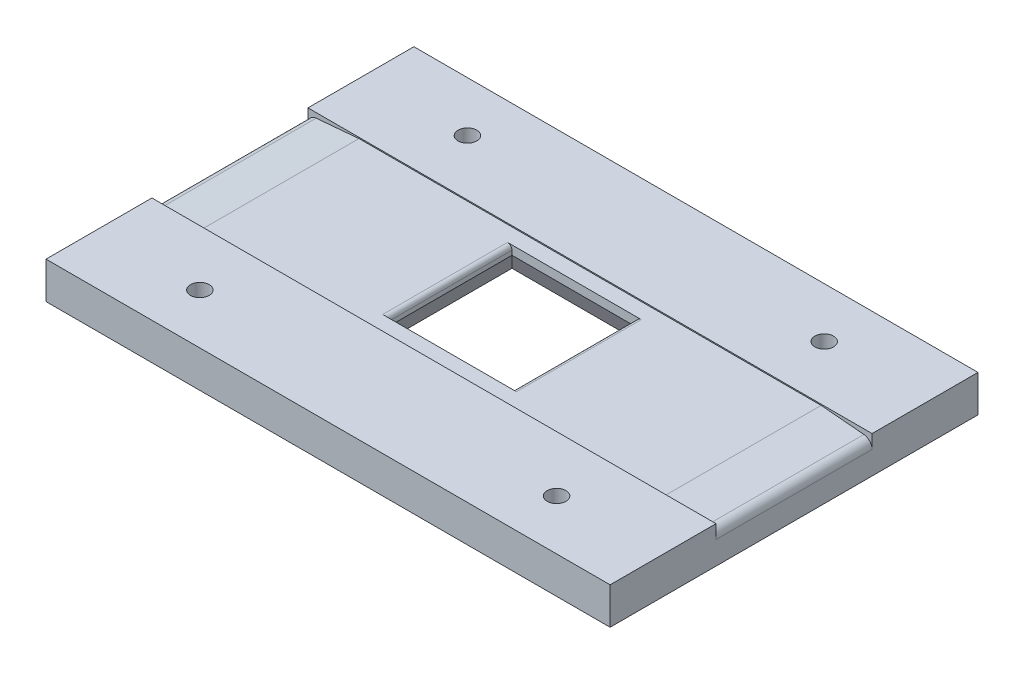
from build123d import *
from OCP.BRepFilletAPI import BRepFilletAPI_MakeChamfer

# Parameters (mm, degrees)
SKETCH_1_W               = 126.5
SKETCH_1_H               = 82.5
SKETCH_1_W_2             = 28
SKETCH_1_H_2             = 28
EXTRUDE_1_DEPTH          = 8
SKETCH_2_W               = 126.5
SKETCH_2_H               = 23.75
EXTRUDE_2_DEPTH          = 0.25
CHAMFER_1_SIZE           = 1
CHAMFER_1_SIZE2          = 11.430052303
FILLET_1_R               = 2
FILLET_2_R               = 1
CUT_EXTRUDE_1_DEPTH      = 76.935005103
CUT_EXTRUDE_1_DEPTH_BACK = 76.935005103
SKETCH_3_R               = 2.1
CHAMFER_2_SIZE           = 6
CHAMFER_2_SIZE2          = 3.464101615
CHAMFER_3_SIZE           = 6
CHAMFER_3_SIZE2          = 3.464101615


with BuildPart() as part:
    # Эскиз1 → Бобышка-Вытянуть1 (new body)
    with BuildSketch(Plane(origin=(0, 0, 0), x_dir=(1, 0, 0), z_dir=(0, 1, 0))):
        Rectangle(SKETCH_1_W, SKETCH_1_H)
        Rectangle(SKETCH_1_W_2, SKETCH_1_H_2, mode=Mode.SUBTRACT)
    extrude(amount=EXTRUDE_1_DEPTH)

    # Эскиз2 → Бобышка-Вытянуть2 (add)
    with BuildSketch(Plane(origin=(0, 8, 0), x_dir=(1, 0, 0), z_dir=(0, 1, 0))):
        with Locations((0, 29.375)):
            Rectangle(SKETCH_2_W, SKETCH_2_H)
        with Locations((0, -29.375)):
            Rectangle(SKETCH_2_W, SKETCH_2_H)
    extrude(amount=EXTRUDE_2_DEPTH)

    # Фаска1: one chamfer whose edges measure the first distance from different faces: ONE call of the kernel's chamfer builder (chamfer() names one face for all edges)
    chamfer_1_edges_1 = [part.edges().sort_by_distance(p)[0] for p in [
        (-63.25, 8, 0),
    ]]
    chamfer_1_side_1 = [part.faces().sort_by_distance(p)[0] for p in [
        (-63.25, 4.072906977, 0),
    ]]
    chamfer_1_edges_2 = [part.edges().sort_by_distance(p)[0] for p in [
        (63.25, 8, 0),
    ]]
    chamfer_1_side_2 = [part.faces().sort_by_distance(p)[0] for p in [
        (63.25, 4.072906977, 0),
    ]]
    chamfer_1 = BRepFilletAPI_MakeChamfer(part.part.solid().wrapped)
    for e in chamfer_1_edges_1:
        chamfer_1.Add(CHAMFER_1_SIZE, CHAMFER_1_SIZE2, e.wrapped, chamfer_1_side_1[0].wrapped)  # the first distance lies on this face
    for e in chamfer_1_edges_2:
        chamfer_1.Add(CHAMFER_1_SIZE, CHAMFER_1_SIZE2, e.wrapped, chamfer_1_side_2[0].wrapped)  # the first distance lies on this face
    add(Compound.cast(chamfer_1.Shape()), mode=Mode.REPLACE)

    # Скругление1
    fillet_1_edges = [part.edges().sort_by_distance(p)[0] for p in [
        (63.25, 7, 0),
        (-63.25, 7, 0),
    ]]
    fillet(fillet_1_edges, radius=FILLET_1_R)

    # Скругление2
    fillet_2_edges = [part.edges().sort_by_distance(p)[0] for p in [
        (-14, 8, 0),
        (14, 8, 0),
    ]]
    fillet(fillet_2_edges, radius=FILLET_2_R)

    # Эскиз3 → Вырез-Вытянуть1 (cut, two sides: drawn at the far end of the back side and taken through both)
    with BuildSketch(Plane(origin=(0, 8, 0), x_dir=(1, 0, 0), z_dir=(0, 1, 0)).offset(-CUT_EXTRUDE_1_DEPTH_BACK)):
        with Locations(Location((-40, 30, 0), (0, 0, 270))):
            Circle(SKETCH_3_R)
        with Locations(Location((40, 30, 0), (0, 0, 270))):
            Circle(SKETCH_3_R)
        with Locations(Location((-40, -30, 0), (0, 0, 270))):
            Circle(SKETCH_3_R)
        with Locations(Location((40, -30, 0), (0, 0, 270))):
            Circle(SKETCH_3_R)
    extrude(amount=CUT_EXTRUDE_1_DEPTH + CUT_EXTRUDE_1_DEPTH_BACK, mode=Mode.SUBTRACT)

    # Фаска2: one chamfer whose edges measure the first distance from different faces: ONE call of the kernel's chamfer builder (chamfer() names one face for all edges)
    chamfer_2_edges_1 = [part.edges().sort_by_distance(p)[0] for p in [
        (-14, 0, 0),
    ]]
    chamfer_2_side_1 = [part.faces().sort_by_distance(p)[0] for p in [
        (-14, 3.5, 0),
    ]]
    chamfer_2_edges_2 = [part.edges().sort_by_distance(p)[0] for p in [
        (14, 0, 0),
    ]]
    chamfer_2_side_2 = [part.faces().sort_by_distance(p)[0] for p in [
        (14, 3.5, 0),
    ]]
    chamfer_2 = BRepFilletAPI_MakeChamfer(part.part.solid().wrapped)
    for e in chamfer_2_edges_1:
        chamfer_2.Add(CHAMFER_2_SIZE, CHAMFER_2_SIZE2, e.wrapped, chamfer_2_side_1[0].wrapped)  # the first distance lies on this face
    for e in chamfer_2_edges_2:
        chamfer_2.Add(CHAMFER_2_SIZE, CHAMFER_2_SIZE2, e.wrapped, chamfer_2_side_2[0].wrapped)  # the first distance lies on this face
    add(Compound.cast(chamfer_2.Shape()), mode=Mode.REPLACE)

    # Фаска3: one chamfer whose edges measure the first distance from different faces: ONE call of the kernel's chamfer builder (chamfer() names one face for all edges)
    chamfer_3_edges_1 = [part.edges().sort_by_distance(p)[0] for p in [
        (0, 0, 14),
    ]]
    chamfer_3_side_1 = [part.faces().sort_by_distance(p)[0] for p in [
        (0, 3.837087991, 14),
    ]]
    chamfer_3_edges_2 = [part.edges().sort_by_distance(p)[0] for p in [
        (0, 0, -14),
    ]]
    chamfer_3_side_2 = [part.faces().sort_by_distance(p)[0] for p in [
        (0, 3.837087991, -14),
    ]]
    chamfer_3 = BRepFilletAPI_MakeChamfer(part.part.solid().wrapped)
    for e in chamfer_3_edges_1:
        chamfer_3.Add(CHAMFER_3_SIZE, CHAMFER_3_SIZE2, e.wrapped, chamfer_3_side_1[0].wrapped)  # the first distance lies on this face
    for e in chamfer_3_edges_2:
        chamfer_3.Add(CHAMFER_3_SIZE, CHAMFER_3_SIZE2, e.wrapped, chamfer_3_side_2[0].wrapped)  # the first distance lies on this face
    add(Compound.cast(chamfer_3.Shape()), mode=Mode.REPLACE)


solid = part.part
